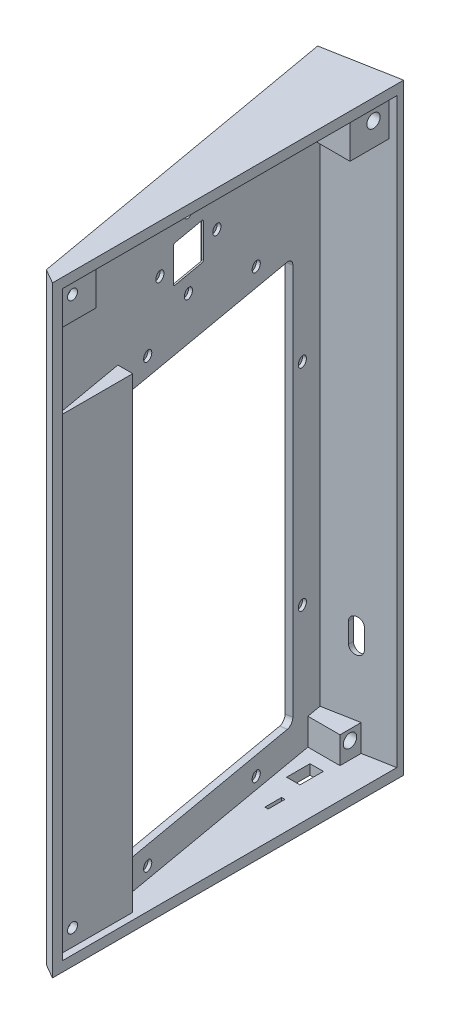
from build123d import *

# Parameters (mm, degrees)
EXTRUDE_1_DEPTH      = 180
SKETCH_5_W           = 76
SKETCH_5_H           = 121
CUT_EXTRUDE_2_DEPTH  = 2
CUT_EXTRUDE_3_REACH  = 232.539
SKETCH_7_W           = 99
SKETCH_7_H           = 174
SKETCH_10_R          = 1.5
CUT_EXTRUDE_5_DEPTH  = 1
SKETCH_11_R          = 1.5
CUT_EXTRUDE_6_DEPTH  = 1
EXTRUDE_3_REACH      = 232.539
SKETCH_12_W          = 23
SKETCH_12_H          = 139.5
SKETCH_13_W          = 11.509871418
SKETCH_13_H          = 121
CUT_EXTRUDE_7_DEPTH  = 2
SKETCH_14_W          = 11
SKETCH_14_H          = 11
CUT_EXTRUDE_8_DEPTH  = 2
SKETCH_17_W          = 22.064106518
SKETCH_17_H          = 180
EXTRUDE_9_DEPTH      = 2
CUT_EXTRUDE_9_DEPTH  = 180
CUT_EXTRUDE_10_DEPTH = 174
SKETCH_20_W          = 23
SKETCH_20_H          = 139.5
CUT_EXTRUDE_11_DEPTH = 2
SKETCH_21_R          = 1.5
CUT_EXTRUDE_12_DEPTH = 1
EXTRUDE_10_REACH     = 232.359
SKETCH_23_W          = 12
SKETCH_23_H          = 12
FILLET_4_R           = 2
CUT_EXTRUDE_15_REACH = 243.825
EXTRUDE_11_REACH     = 232.539
SKETCH_27_W          = 8
SKETCH_27_H          = 8
SKETCH_28_W          = 8
SKETCH_28_H          = 8
CUT_EXTRUDE_16_DEPTH = 9
EXTRUDE_12_DEPTH     = 8
CUT_EXTRUDE_17_REACH = 243.825
CUT_EXTRUDE_18_REACH = 246.03
SKETCH_31_W          = 4
SKETCH_31_H          = 7
CUT_EXTRUDE_23_REACH = 225.195
CUT_EXTRUDE_25_REACH = 224.966
SKETCH_35_W          = 8
SKETCH_35_H          = 16
FILLET_5_R           = 0.5
CUT_EXTRUDE_26_REACH = 246.03
SKETCH_36_W          = 1
SKETCH_36_H          = 5
SKETCH_37_W          = 2
SKETCH_37_H          = 6
CUT_EXTRUDE_27_DEPTH = 1
SKETCH_38_R          = 2
CUT_EXTRUDE_28_DEPTH = 3
SKETCH_39_R          = 2
CUT_EXTRUDE_30_DEPTH = 3
SKETCH_40_R          = 1.5
CUT_EXTRUDE_31_DEPTH = 2
CUT_EXTRUDE_START    = -2
CUT_EXTRUDE_34_DEPTH = 2
CHAMFER_1_SIZE       = 2
CHAMFER_1_SIZE2      = 1.5
FILLET_6_R           = 0.5


with BuildPart() as part:
    # 草图1 → 凸台-拉伸1 (new body)
    with BuildSketch(Plane(origin=(0, 0, 0), x_dir=(1, 0, 0), z_dir=(0, 1, 0))):
        Polygon((82.903530501, -37.399262949), (82.903530501, -142.399262949), (78.573403482, -139.899262949), (61.208585715, -41.418487648), align=None)
    extrude(amount=EXTRUDE_1_DEPTH)

    # 草图5 → 切除-拉伸2 (cut)
    with BuildSketch(Plane(origin=(52.279942479, 0, -9.218364409), x_dir=(0.17364817766692414, 0, 0.9848077530122091), z_dir=(-0.9848077530122091, 0, 0.17364817766692414))):
        with Locations((101.418007121, 72.5)):
            Rectangle(SKETCH_5_W, SKETCH_5_H)
    extrude(amount=-CUT_EXTRUDE_2_DEPTH, mode=Mode.SUBTRACT)

    # 切除-拉伸3: up to this plane
    cut_extrude_3_end = Plane(origin=(54.249557985, 0, -9.565660764), z_dir=(-0.9848077530122091, 0, 0.17364817766692406))
    # 草图7 → 切除-拉伸3 (cut, up to the surface)
    with BuildSketch(Plane(origin=(82.903530501, 0, 0), x_dir=(0, 0, -1), z_dir=(1, 0, 0)), mode=Mode.PRIVATE) as cut_extrude_3_sk1:
        with Locations((-89.899262949, 90)):
            Rectangle(SKETCH_7_W, SKETCH_7_H)
    cut_extrude_3_tool1 = split(extrude(cut_extrude_3_sk1.sketch, amount=-CUT_EXTRUDE_3_REACH, mode=Mode.PRIVATE), bisect_by=cut_extrude_3_end, keep=Keep.BOTH, mode=Mode.PRIVATE)
    add(cut_extrude_3_tool1.solids().sort_by_distance((82.903531, 90, 89.899263))[0], mode=Mode.SUBTRACT)

    # 草图10 → 切除-拉伸5 (cut)
    with BuildSketch(Plane(origin=(54.249557985, 0, -9.565660764), x_dir=(-0.1736481776669242, 0, -0.9848077530122091), z_dir=(0.9848077530122091, 0, -0.1736481776669242))):
        with Locations((-59.918007121, 104)):
            Circle(SKETCH_10_R)
        with Locations((-59.918007121, 41)):
            Circle(SKETCH_10_R)
    extrude(amount=-CUT_EXTRUDE_5_DEPTH, mode=Mode.SUBTRACT)

    # 草图11 → 切除-拉伸6 (cut)
    with BuildSketch(Plane(origin=(54.249557985, 0, -9.565660764), x_dir=(-0.1736481776669242, 0, -0.9848077530122091), z_dir=(0.9848077530122091, 0, -0.1736481776669242))):
        with Locations((-116.918007121, 138.5)):
            Circle(SKETCH_11_R)
        with Locations((-76.918007121, 138.5)):
            Circle(SKETCH_11_R)
        with Locations((-116.918007121, 6.5)):
            Circle(SKETCH_11_R)
        with Locations((-76.918007121, 6.5)):
            Circle(SKETCH_11_R)
    extrude(amount=-CUT_EXTRUDE_6_DEPTH, mode=Mode.SUBTRACT)

    # 凸台-拉伸3: up to this plane
    extrude_3_end = Plane(origin=(54.249557985, 0, -9.565660764), z_dir=(-0.9848077530122091, 0, 0.17364817766692406))
    # 草图12 → 凸台-拉伸3 (add, up to the surface)
    with BuildSketch(Plane(origin=(82.903530501, 0, 0), x_dir=(0, 0, -1), z_dir=(1, 0, 0)), mode=Mode.PRIVATE) as extrude_3_sk1:
        with Locations((-127.899262949, 72.75)):
            Rectangle(SKETCH_12_W, SKETCH_12_H)
    extrude_3_tool1 = split(extrude(extrude_3_sk1.sketch, amount=-EXTRUDE_3_REACH, mode=Mode.PRIVATE), bisect_by=extrude_3_end, keep=Keep.BOTH, mode=Mode.PRIVATE)
    add(extrude_3_tool1.solids().sort_by_distance((82.903531, 72.75, 127.899263))[0])

    # 草图13 → 切除-拉伸7 (cut)
    with BuildSketch(Plane(origin=(54.249557985, 0, -9.565660764), x_dir=(0.1736481776669242, 0, 0.9848077530122091), z_dir=(-0.9848077530122091, 0, 0.1736481776669242))):
        with Locations((133.663071412, 72.5)):
            Rectangle(SKETCH_13_W, SKETCH_13_H)
    extrude(amount=-CUT_EXTRUDE_7_DEPTH, mode=Mode.SUBTRACT)

    # 草图14 → 切除-拉伸8 (cut)
    with BuildSketch(Plane(origin=(52.279942479, 0, -9.218364409), x_dir=(0.17364817766692414, 0, 0.9848077530122091), z_dir=(-0.9848077530122091, 0, 0.17364817766692414))):
        with Locations((101.918007121, 156.5)):
            Rectangle(SKETCH_14_W, SKETCH_14_H)
    extrude(amount=-CUT_EXTRUDE_8_DEPTH, mode=Mode.SUBTRACT)

    # 草图17 → 凸台-拉伸9 (add)
    with BuildSketch(Plane(origin=(9.44967418, 0, 51.007389472), x_dir=(-0.9832686752161511, 0, 0.18216122622192457), z_dir=(-0.18216122622192457, 0, -0.9832686752161512))):
        with Locations((-63.671695749, 90)):
            Rectangle(SKETCH_17_W, SKETCH_17_H)
    extrude(amount=-EXTRUDE_9_DEPTH)

    # 草图18 → 切除-拉伸9 (cut)
    with BuildSketch(Plane.XZ):
        Polygon((82.903530501, 39.433295), (82.903530501, 37.399262949), (83.267852953, 39.3658003), align=None)
    extrude(amount=-CUT_EXTRUDE_9_DEPTH, mode=Mode.SUBTRACT)

    # 草图19 → 切除-拉伸10 (cut)
    with BuildSketch(Plane(origin=(0, 3, 0), x_dir=(1, 0, 0), z_dir=(0, 1, 0))):
        Polygon((77.596007668, -40.416571384), (82.903530501, -39.433295), (82.903530501, -40.399262949), align=None)
    extrude(amount=CUT_EXTRUDE_10_DEPTH, mode=Mode.SUBTRACT)

    # 草图20 → 切除-拉伸11 (cut)
    with BuildSketch(Plane(origin=(82.903530501, 0, 0), x_dir=(0, 0, -1), z_dir=(1, 0, 0))):
        with Locations((-127.899262949, 72.75)):
            Rectangle(SKETCH_20_W, SKETCH_20_H)
    extrude(amount=-CUT_EXTRUDE_11_DEPTH, mode=Mode.SUBTRACT)

    # 草图21 → 切除-拉伸12 (cut)
    with BuildSketch(Plane(origin=(54.249557985, 0, -9.565660764), x_dir=(-0.17364817766692422, 0, -0.9848077530122091), z_dir=(0.9848077530122092, 0, -0.17364817766692422))):
        with Locations((-112.418007121, 156.5)):
            Circle(SKETCH_21_R)
        with Locations((-91.418007121, 156.5)):
            Circle(SKETCH_21_R)
        with Locations((-101.918007121, 146)):
            Circle(SKETCH_21_R)
        with Locations((-101.918007121, 167)):
            Circle(SKETCH_21_R)
    extrude(amount=-CUT_EXTRUDE_12_DEPTH, mode=Mode.SUBTRACT)

    # 凸台-拉伸10: up to this plane
    extrude_10_end = Plane(origin=(54.249557985, 0, -9.565660764), z_dir=(-0.9848077530122091, 0, 0.17364817766692406))
    # 草图23 → 凸台-拉伸10 (add, up to the surface)
    with BuildSketch(Plane(origin=(80.903530501, 0, 0), x_dir=(0, 0, -1), z_dir=(1, 0, 0)), mode=Mode.PRIVATE) as extrude_10_sk1:
        with Locations((-133.399262949, 9)):
            Rectangle(SKETCH_23_W, SKETCH_23_H)
    extrude_10_tool1 = split(extrude(extrude_10_sk1.sketch, amount=-EXTRUDE_10_REACH, mode=Mode.PRIVATE), bisect_by=extrude_10_end, keep=Keep.BOTH, mode=Mode.PRIVATE)
    add(extrude_10_tool1.solids().sort_by_distance((80.903531, 9, 133.399263))[0])
    # 草图23 → 凸台-拉伸10 (add, up to the surface)
    with BuildSketch(Plane(origin=(80.903530501, 0, 0), x_dir=(0, 0, -1), z_dir=(1, 0, 0)), mode=Mode.PRIVATE) as extrude_10_sk2:
        with Locations((-45.433295, 171)):
            Rectangle(SKETCH_23_W, SKETCH_23_H)
    extrude_10_tool2 = split(extrude(extrude_10_sk2.sketch, amount=-EXTRUDE_10_REACH, mode=Mode.PRIVATE), bisect_by=extrude_10_end, keep=Keep.BOTH, mode=Mode.PRIVATE)
    add(extrude_10_tool2.solids().sort_by_distance((80.903531, 171, 45.433295))[0])
    # 草图23 → 凸台-拉伸10 (add, up to the surface)
    with BuildSketch(Plane(origin=(80.903530501, 0, 0), x_dir=(0, 0, -1), z_dir=(1, 0, 0)), mode=Mode.PRIVATE) as extrude_10_sk3:
        with Locations((-133.399262949, 171)):
            Rectangle(SKETCH_23_W, SKETCH_23_H)
    extrude_10_tool3 = split(extrude(extrude_10_sk3.sketch, amount=-EXTRUDE_10_REACH, mode=Mode.PRIVATE), bisect_by=extrude_10_end, keep=Keep.BOTH, mode=Mode.PRIVATE)
    add(extrude_10_tool3.solids().sort_by_distance((80.903531, 171, 133.399263))[0])

    # 圆角4
    fillet_4_edges = [part.edges().sort_by_distance(p)[0] for p in [
        (78.459240856, 133, 127.734273558),
        (64.2771716, 12, 53.062532507),
        (64.2771716, 133, 53.062532507),
        (77.474433103, 12, 127.907921736),
    ]]
    fillet(fillet_4_edges, radius=FILLET_4_R)

    # 草图26 → 切除-拉伸15 (cut, up to next)
    with BuildSketch(Plane(origin=(0, 177, 0), x_dir=(1, 0, 0), z_dir=(0, 1, 0)), mode=Mode.PRIVATE) as cut_extrude_15_sk1:
        Polygon((63.175196657, -41.054151562), (71.924245603, -39.433295), (62.889395913, -39.433295), align=None)
    cut_extrude_15_tool1 = extrude(cut_extrude_15_sk1.sketch, amount=-CUT_EXTRUDE_15_REACH, mode=Mode.PRIVATE) & part.part
    add(cut_extrude_15_tool1.solids().sort_by_distance((65.996279, 177, 39.973581))[0], mode=Mode.SUBTRACT)

    # 凸台-拉伸11: up to this plane
    extrude_11_end = Plane(origin=(54.249557985, 0, -9.565660764), z_dir=(-0.9848077530122091, 0, 0.17364817766692406))
    # 草图27 → 凸台-拉伸11 (add, up to the surface)
    with BuildSketch(Plane(origin=(82.903530501, 0, 0), x_dir=(0, 0, -1), z_dir=(1, 0, 0)), mode=Mode.PRIVATE) as extrude_11_sk1:
        with Locations((-43.433295, 7)):
            Rectangle(SKETCH_27_W, SKETCH_27_H)
    extrude_11_tool1 = split(extrude(extrude_11_sk1.sketch, amount=-EXTRUDE_11_REACH, mode=Mode.PRIVATE), bisect_by=extrude_11_end, keep=Keep.BOTH, mode=Mode.PRIVATE)
    add(extrude_11_tool1.solids().sort_by_distance((82.903531, 7, 43.433295))[0])

    # 草图28 → 切除-拉伸16 (cut)
    with BuildSketch(Plane(origin=(82.903530501, 0, 0), x_dir=(0, 0, -1), z_dir=(1, 0, 0))):
        with Locations((-43.433295, 7)):
            Rectangle(SKETCH_28_W, SKETCH_28_H)
    extrude(amount=-CUT_EXTRUDE_16_DEPTH, mode=Mode.SUBTRACT)

    # 草图29 → 凸台-拉伸12 (add)
    with BuildSketch(Plane.XZ.offset(-11)):
        Polygon((73.903530501, 41.100642977), (73.903530501, 39.433295), (82.903530501, 39.433295), align=None)
    extrude(amount=EXTRUDE_12_DEPTH)

    # 草图30 → 切除-拉伸17 (cut, up to next)
    with BuildSketch(Plane.XZ.offset(-3), mode=Mode.PRIVATE) as cut_extrude_17_sk1:
        Polygon((71.924245603, 39.433295), (63.175196657, 41.054151562), (62.889395913, 39.433295), align=None)
    cut_extrude_17_tool1 = extrude(cut_extrude_17_sk1.sketch, amount=-CUT_EXTRUDE_17_REACH, mode=Mode.PRIVATE) & part.part
    add(cut_extrude_17_tool1.solids().sort_by_distance((65.996279, 3, 39.973581))[0], mode=Mode.SUBTRACT)

    # 草图31 → 切除-拉伸18 (cut, up to next)
    with BuildSketch(Plane.XZ, mode=Mode.PRIVATE) as cut_extrude_18_sk1:
        with Locations((70.903530501, 54.899262949)):
            Rectangle(SKETCH_31_W, SKETCH_31_H)
    cut_extrude_18_tool1 = extrude(cut_extrude_18_sk1.sketch, amount=-CUT_EXTRUDE_18_REACH, mode=Mode.PRIVATE) & part.part
    add(cut_extrude_18_tool1.solids().sort_by_distance((70.903531, 0, 54.899263))[0], mode=Mode.SUBTRACT)

    # 切除-拉伸23: up to this plane
    cut_extrude_23_end = Plane(origin=(9.813996633, 0, 52.973926823), z_dir=(-0.18216122622192446, 0, -0.9832686752161511))
    # 草图32 → 切除-拉伸23 (cut, up to the surface)
    with BuildSketch(Plane(origin=(0, 0, 39.719262949), x_dir=(-1, 0, 0), z_dir=(0, 0, -1)), mode=Mode.PRIVATE) as cut_extrude_23_sk1:
        with BuildLine():
            Line((-70.708585715, 36), (-70.708585715, 30))
            ThreePointArc((-70.708585715, 30), (-72.708585715, 28), (-74.708585715, 30))
            Line((-74.708585715, 30), (-74.708585715, 36))
            ThreePointArc((-74.708585715, 36), (-72.708585715, 38), (-70.708585715, 36))
        make_face()
    cut_extrude_23_tool1 = split(extrude(cut_extrude_23_sk1.sketch, amount=-CUT_EXTRUDE_23_REACH, mode=Mode.PRIVATE), bisect_by=cut_extrude_23_end, keep=Keep.BOTH, mode=Mode.PRIVATE)
    add(cut_extrude_23_tool1.solids().sort_by_distance((72.708586, 33, 39.719263))[0], mode=Mode.SUBTRACT)

    # 切除-拉伸25: up to this plane
    cut_extrude_25_end = Plane(origin=(61.208585715, 180, 41.418487648), z_dir=(0.18216122622192454, 0, 0.9832686752161511))
    # 草图35 → 切除-拉伸25 (cut, up to the surface)
    with BuildSketch(Plane(origin=(0, 0, 40.219262949), x_dir=(-1, 0, 0), z_dir=(0, 0, -1)), mode=Mode.PRIVATE) as cut_extrude_25_sk1:
        with Locations((-72.708585715, 33)):
            Rectangle(SKETCH_35_W, SKETCH_35_H)
    cut_extrude_25_tool1 = split(extrude(cut_extrude_25_sk1.sketch, amount=CUT_EXTRUDE_25_REACH, mode=Mode.PRIVATE), bisect_by=cut_extrude_25_end, keep=Keep.BOTH, mode=Mode.PRIVATE)
    add(cut_extrude_25_tool1.solids().sort_by_distance((72.708586, 33, 40.219263))[0], mode=Mode.SUBTRACT)

    # 圆角5
    fillet_5_edges = [part.edges().sort_by_distance(p)[0] for p in [
        (68.708585715, 41, 40.124146975),
        (68.708585715, 25, 40.124146975),
        (76.708585715, 25, 39.38310343),
        (76.708585715, 41, 39.38310343),
    ]]
    fillet(fillet_5_edges, radius=FILLET_5_R)

    # 草图36 → 切除-拉伸26 (cut, up to next)
    with BuildSketch(Plane.XZ, mode=Mode.PRIVATE) as cut_extrude_26_sk1:
        with Locations((73.903530501, 66.899262949)):
            Rectangle(SKETCH_36_W, SKETCH_36_H)
    cut_extrude_26_tool1 = extrude(cut_extrude_26_sk1.sketch, amount=-CUT_EXTRUDE_26_REACH, mode=Mode.PRIVATE) & part.part
    add(cut_extrude_26_tool1.solids().sort_by_distance((73.903531, 0, 66.899263))[0], mode=Mode.SUBTRACT)

    # 草图37 → 切除-拉伸27 (cut)
    with BuildSketch(Plane.XZ):
        with Locations((73.903530501, 66.899262949)):
            Rectangle(SKETCH_37_W, SKETCH_37_H)
    extrude(amount=-CUT_EXTRUDE_27_DEPTH, mode=Mode.SUBTRACT)

    # 草图38 → 切除-拉伸28 (cut)
    with BuildSketch(Plane(origin=(73.903530501, 0, 0), x_dir=(0, 0, -1), z_dir=(1, 0, 0))):
        with Locations((-44.433295, 8)):
            Circle(SKETCH_38_R)
    extrude(amount=-CUT_EXTRUDE_28_DEPTH, mode=Mode.SUBTRACT)

    # 草图39 → 切除-拉伸30 (cut)
    with BuildSketch(Plane(origin=(80.903530501, 0, 0), x_dir=(0, 0, -1), z_dir=(1, 0, 0))):
        with Locations((-44.433295, 172)):
            Circle(SKETCH_39_R)
    extrude(amount=-CUT_EXTRUDE_30_DEPTH, mode=Mode.SUBTRACT)

    # 草图40 → 切除-拉伸31 (cut)
    with BuildSketch(Plane(origin=(80.903530501, 0, 0), x_dir=(0, 0, -1), z_dir=(1, 0, 0))):
        with Locations((-134.399262949, 172)):
            Circle(SKETCH_40_R)
        with Locations((-134.399262949, 8)):
            Circle(SKETCH_40_R)
    extrude(amount=-CUT_EXTRUDE_31_DEPTH, mode=Mode.SUBTRACT)

    # 草图42 → 切除-拉伸34 (cut)
    with BuildSketch(Plane(origin=(54.249557985, 0, -9.565660764), x_dir=(0.17364817766692428, 0, 0.9848077530122091), z_dir=(-0.9848077530122092, 0, 0.17364817766692428)).offset(CUT_EXTRUDE_START)):
        with BuildLine():
            Line((139.077828434, 15), (139.077828434, 12.884207363))
            ThreePointArc((139.077828434, 12.884207363), (139.331073067, 13.416751608), (139.418007121, 14))
            Line((139.418007121, 14), (139.418007121, 15))
            Line((139.418007121, 15), (139.077828434, 15))
        make_face()
    extrude(amount=CUT_EXTRUDE_34_DEPTH, mode=Mode.SUBTRACT)

    # 倒角1
    chamfer_1_edges = [part.edges().sort_by_distance(p)[0] for p in [
        (69.02275371, 156.5, 85.734836534),
        (69.977818687, 151, 91.151279175),
        (70.932883665, 156.5, 96.567721817),
        (69.977818687, 162, 91.151279175),
    ]]
    chamfer_1_side = [part.faces().sort_by_distance(p)[0] for p in [
        (76.847188832, 72.5, 130.10941319),
    ]]
    chamfer(chamfer_1_edges, length=CHAMFER_1_SIZE, length2=CHAMFER_1_SIZE2, reference=chamfer_1_side[0])

    # 圆角6
    fillet_6_edges = [part.edges().sort_by_distance(p)[0] for p in [
        (70.746167278, 151, 85.430952223),
        (70.746167278, 162, 85.430952223),
        (72.656297232, 162, 96.263837506),
        (72.656297232, 151, 96.263837506),
    ]]
    fillet(fillet_6_edges, radius=FILLET_6_R)


solid = part.part
